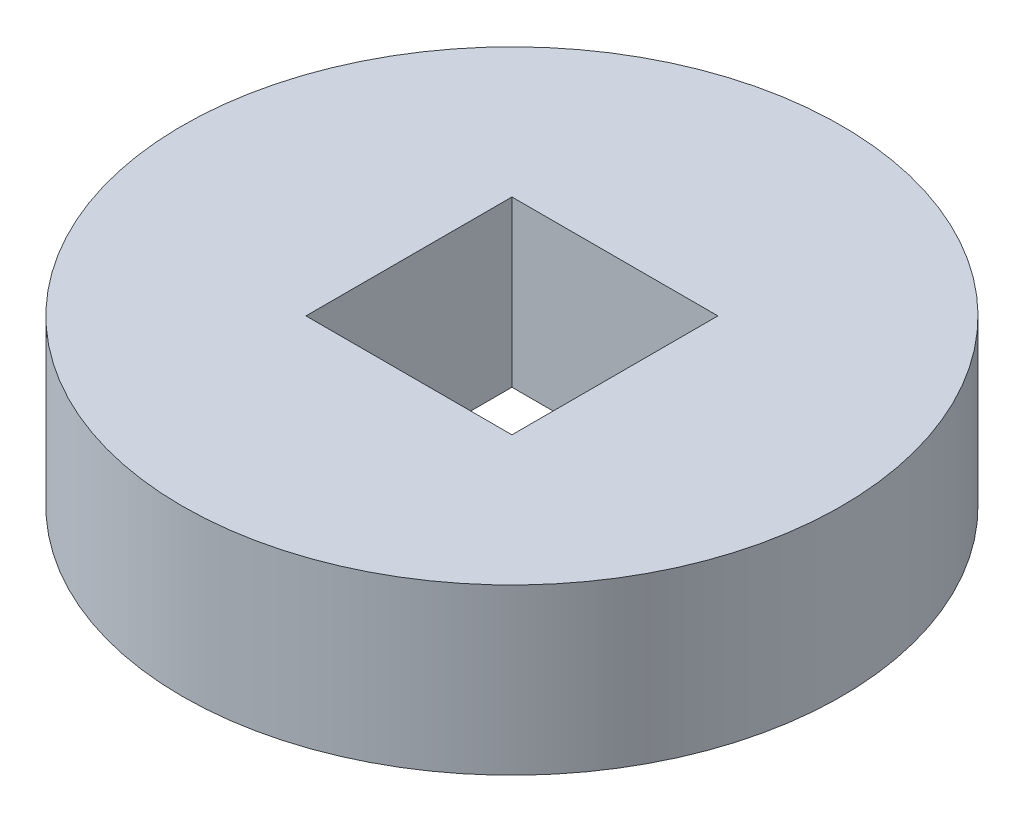
from build123d import *

# Parameters (mm, degrees)
SKETCH1_R           = 40
SKETCH1_W           = 25
SKETCH1_H           = 25
BOSS_EXTRUDE1_DEPTH = 20


with BuildPart() as part:
    # Sketch1 → Boss-Extrude1 (new body)
    with BuildSketch(Plane(origin=(0, 0, 0), x_dir=(1, 0, 0), z_dir=(0, 1, 0))):
        with Locations(Location((0, 0, 0), (0, 0, 270))):
            Circle(SKETCH1_R)
        Rectangle(SKETCH1_W, SKETCH1_H, mode=Mode.SUBTRACT)
    extrude(amount=BOSS_EXTRUDE1_DEPTH)


solid = part.part
